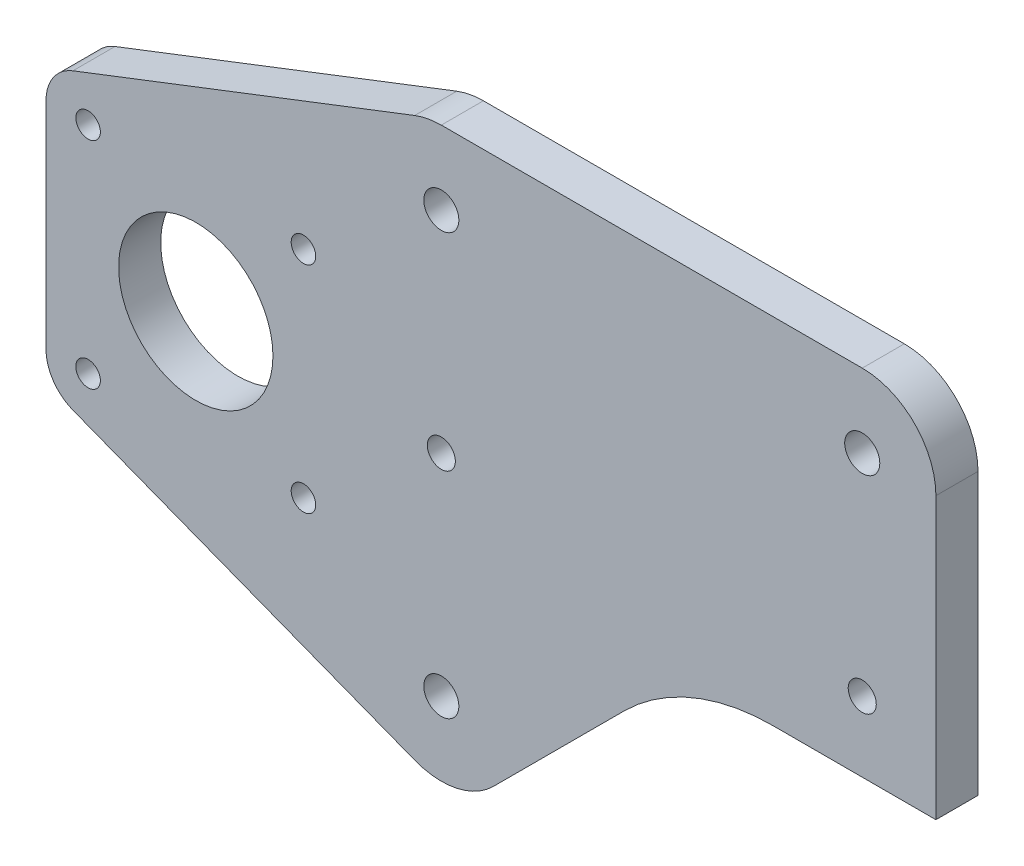
from build123d import *

# Parameters (mm, degrees)
ESBO_O1_R                = 2.5
ESBO_O1_R_2              = 1.75
ESBO_O1_R_3              = 11
ESBO_O1_R_4              = 2
RESSALTO_EXTRUS_O1_DEPTH = 6


with BuildPart() as part:
    # Esboço1 → Ressalto-extrusão1 (new body)
    with BuildSketch(Plane.XY):
        with BuildLine():
            Line((-22.575378798, -37.424621202), (-3.937554159, -18.786796564))
            ThreePointArc((-3.937554159, -18.786796564), (5.795146305, -12.283614025), (17.275649276, -10))
            Line((17.275649276, -10), (40.5, -10))
            Line((40.5, -10), (40.5, 30))
            ThreePointArc((40.5, 30), (37.424621202, 37.424621202), (30, 40.5))
            Line((30, 40.5), (-30, 40.5))
            ThreePointArc((-30, 40.5), (-31.926738888, 40.321709028), (-33.788045366, 39.792890906))
            Line((-33.788045366, 39.792890906), (-82.513696647, 20.945036955))
            ThreePointArc((-82.513696647, 20.945036955), (-85.298219626, 18.741179474), (-86.349099295, 15.349099295))
            Line((-86.349099295, 15.349099295), (-86.349099295, -15.349099295))
            ThreePointArc((-86.349099295, -15.349099295), (-85.298219626, -18.741179474), (-82.513696647, -20.945036955))
            Line((-82.513696647, -20.945036955), (-33.788045366, -39.792890906))
            ThreePointArc((-33.788045366, -39.792890906), (-27.830127584, -40.273346762), (-22.575378798, -37.424621202))
        make_face()
        with Locations((-30, 30)):
            Circle(ESBO_O1_R, mode=Mode.SUBTRACT)
        with Locations((-30, -30)):
            Circle(ESBO_O1_R, mode=Mode.SUBTRACT)
        with Locations((30, 30)):
            Circle(ESBO_O1_R, mode=Mode.SUBTRACT)
        with Locations((-80.349099295, 15.349099295)):
            Circle(ESBO_O1_R_2, mode=Mode.SUBTRACT)
        with Locations((-49.650900705, 15.349099295)):
            Circle(ESBO_O1_R_2, mode=Mode.SUBTRACT)
        with Locations((-49.650900705, -15.349099295)):
            Circle(ESBO_O1_R_2, mode=Mode.SUBTRACT)
        with Locations((-80.349099295, -15.349099295)):
            Circle(ESBO_O1_R_2, mode=Mode.SUBTRACT)
        with Locations((-65, 0)):
            Circle(ESBO_O1_R_3, mode=Mode.SUBTRACT)
        with Locations((-30, 0)):
            Circle(ESBO_O1_R_4, mode=Mode.SUBTRACT)
        with Locations((30, 0)):
            Circle(ESBO_O1_R_4, mode=Mode.SUBTRACT)
    extrude(amount=RESSALTO_EXTRUS_O1_DEPTH)


solid = part.part
